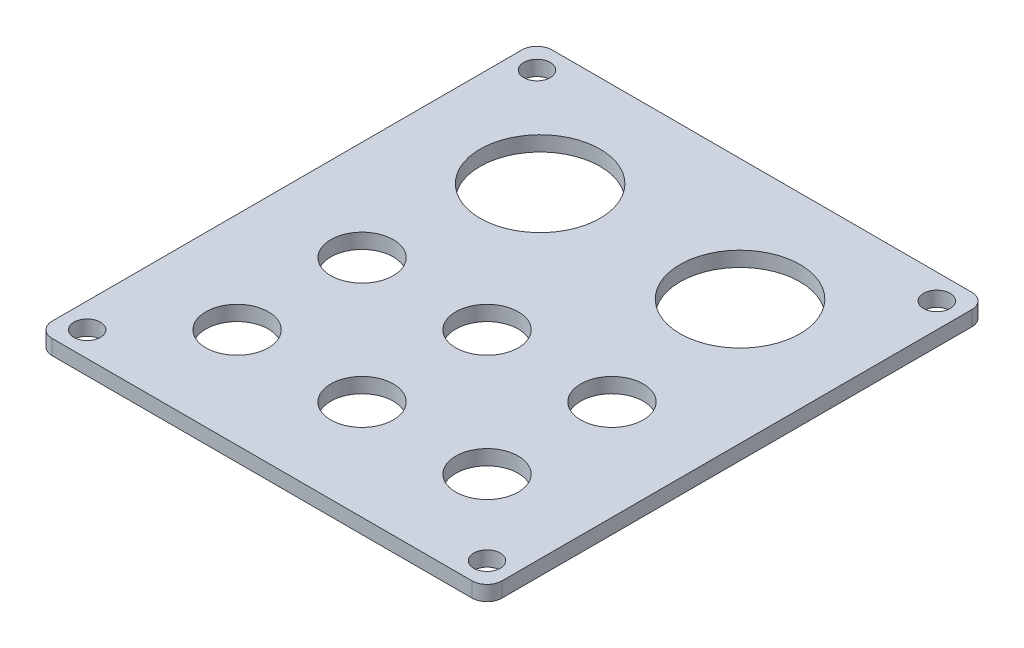
from build123d import *

# Parameters (mm, degrees)
SKETCH1_W            = 90
SKETCH1_H            = 100
BOSS_EXTRUDE1_DEPTH  = 3
SKETCH2_R            = 6.25
CUT_EXTRUDE1_DEPTH   = 3
LPATTERN1_COUNT      = 3
LPATTERN1_PITCH      = 25
LPATTERN1_COUNT_DIR2 = 2
LPATTERN1_PITCH_DIR2 = 25
SKETCH3_R            = 12
CUT_EXTRUDE2_DEPTH   = 3
M5_CLEARANCE_HOLE1_D = 5.3
FILLET1_R            = 3


with BuildPart() as part:
    # Sketch1 → Boss-Extrude1 (new body)
    with BuildSketch(Plane(origin=(0, 0, 0), x_dir=(1, 0, 0), z_dir=(0, 1, 0))):
        with Locations((45, 50)):
            Rectangle(SKETCH1_W, SKETCH1_H)
    extrude(amount=BOSS_EXTRUDE1_DEPTH)

    # Sketch2 → Cut-Extrude1 (cut)
    with BuildSketch(Plane(origin=(0, 3, 0), x_dir=(1, 0, 0), z_dir=(0, 1, 0))):
        with Locations(Location((20, 20, 0), (0, 0, 270))):
            Circle(SKETCH2_R)
    cut_extrude1 = extrude(amount=-CUT_EXTRUDE1_DEPTH, mode=Mode.SUBTRACT)

    # LPattern1: Cut-Extrude1 3 × 2
    with Locations(*[(i * LPATTERN1_PITCH, 0, -j * LPATTERN1_PITCH_DIR2) for i in range(LPATTERN1_COUNT) for j in range(LPATTERN1_COUNT_DIR2) if (i, j) != (0, 0)]):
        add(cut_extrude1, mode=Mode.SUBTRACT)

    # Sketch3 → Cut-Extrude2 (cut)
    with BuildSketch(Plane(origin=(0, 3, 0), x_dir=(1, 0, 0), z_dir=(0, 1, 0))):
        with Locations(Location((25, 75.625, 0), (0, 0, 270))):
            Circle(SKETCH3_R)
        with Locations(Location((65, 75.625, 0), (0, 0, 270))):
            Circle(SKETCH3_R)
    extrude(amount=-CUT_EXTRUDE2_DEPTH, mode=Mode.SUBTRACT)

    # M5 Clearance Hole1 (through all)
    with Locations(Plane(origin=(0, 3, 0), x_dir=(1, 0, 0), z_dir=(0, 1, 0))):
        with Locations((5, 95), (5, 5), (85, 5), (85, 95)):
            Hole(M5_CLEARANCE_HOLE1_D / 2)

    # Fillet1
    fillet1_edges = [part.edges().sort_by_distance(p)[0] for p in [
        (0, 1.5, -100),
        (90, 1.5, -100),
        (90, 1.5, 0),
        (0, 1.5, 0),
    ]]
    fillet(fillet1_edges, radius=FILLET1_R)


solid = part.part
